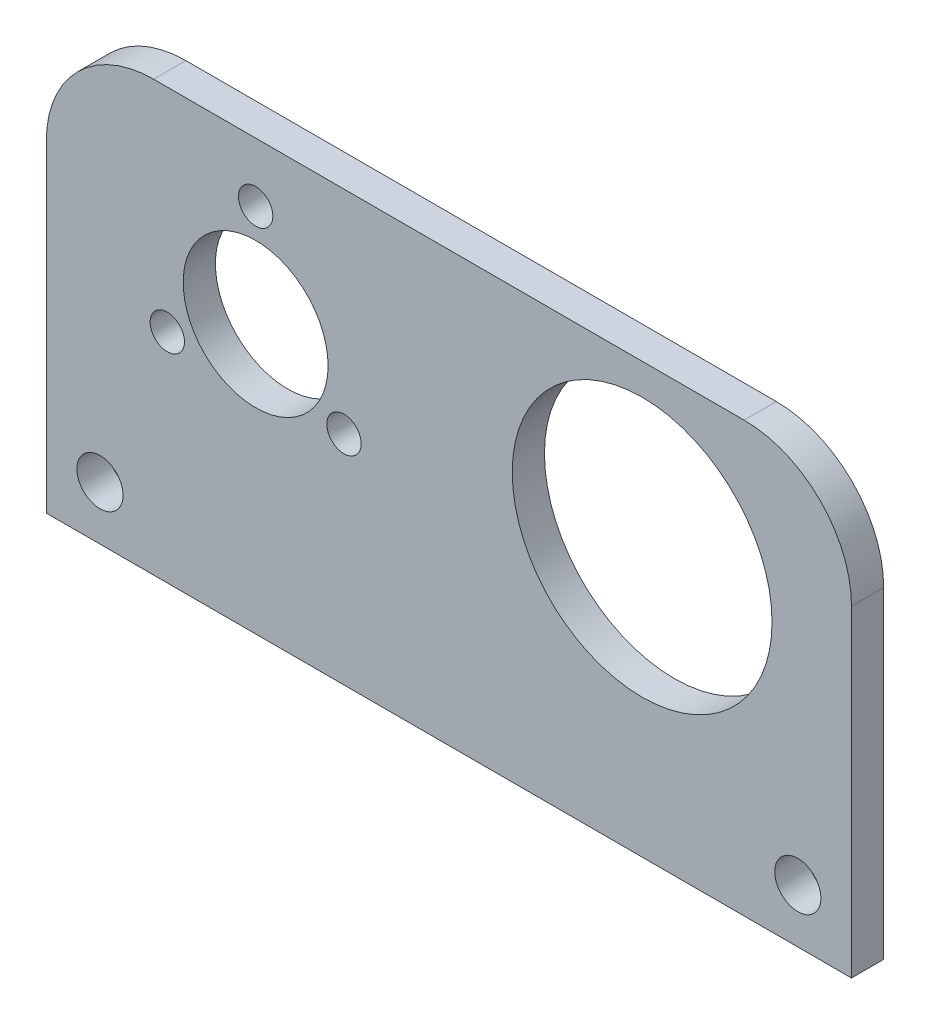
from build123d import *

# Parameters (mm, degrees)
SKETCH_1_W      = 75
SKETCH_1_H      = 40
SKETCH_1_R      = 6.75
SKETCH_1_R_2    = 1.6
SKETCH_1_R_3    = 12.1
SKETCH_1_R_4    = 2.15
EXTRUDE_1_DEPTH = 3
FILLET_1_R      = 10


with BuildPart() as part:
    # ｽｹｯﾁ1 → ﾎﾞｽ - 押し出し1 (new body)
    with BuildSketch(Plane.XY):
        with Locations((37.5, 20)):
            Rectangle(SKETCH_1_W, SKETCH_1_H)
        with Locations((19.5, 25)):
            Circle(SKETCH_1_R, mode=Mode.SUBTRACT)
        with Locations((19.5, 34.5)):
            Circle(SKETCH_1_R_2, mode=Mode.SUBTRACT)
        with Locations((27.727241336, 20.25)):
            Circle(SKETCH_1_R_2, mode=Mode.SUBTRACT)
        with Locations((11.272758664, 20.25)):
            Circle(SKETCH_1_R_2, mode=Mode.SUBTRACT)
        with Locations((55.5, 25)):
            Circle(SKETCH_1_R_3, mode=Mode.SUBTRACT)
        with Locations((5, 5)):
            Circle(SKETCH_1_R_4, mode=Mode.SUBTRACT)
        with Locations(Location((70, 5, 0), (0, 0, 180))):
            Circle(SKETCH_1_R_4, mode=Mode.SUBTRACT)
    extrude(amount=EXTRUDE_1_DEPTH)

    # ﾌｨﾚｯﾄ1
    fillet_1_edges = [part.edges().sort_by_distance(p)[0] for p in [
        (0, 40, 1.5),
        (75, 40, 1.5),
    ]]
    fillet(fillet_1_edges, radius=FILLET_1_R)


solid = part.part
